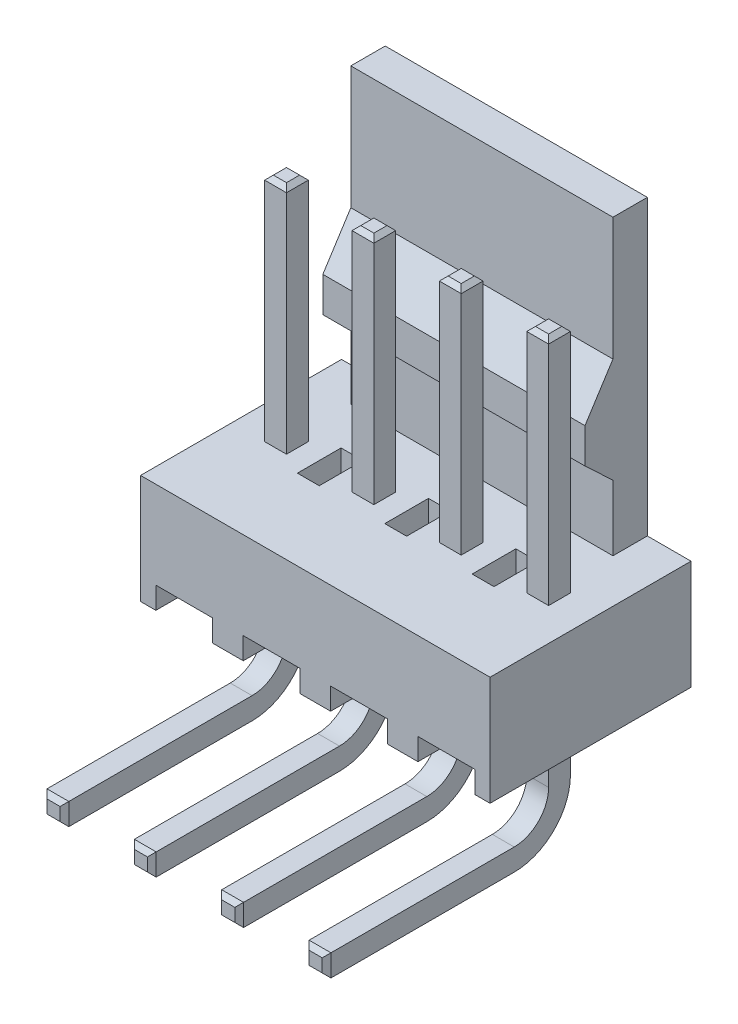
from build123d import *

# Parameters (mm, degrees)
SKETCH1_W            = 8.89
SKETCH1_H            = 5.842
BOSS_EXTRUDE1_DEPTH  = 3.175
BOSS_EXTRUDE2_DEPTH  = 7.62
SKETCH3_W            = 5.842
SKETCH3_H            = 3.175
BOSS_EXTRUDE3_DEPTH  = 1.27
SKETCH4_W            = 1.651
SKETCH4_H            = 0.635
CUT_EXTRUDE1_DEPTH   = 13.735698656
SKETCH5_W            = 0.635
SKETCH5_H            = 0.635
BOSS_EXTRUDE4_DEPTH  = 3.6725
SKETCH6_W            = 0.635
SKETCH6_H            = 0.635
BOSS_EXTRUDE5_DEPTH  = 6.4543
SKETCH7_W            = 1.651
SKETCH7_H            = 0.635
CUT_EXTRUDE2_DEPTH   = 15.867320547
SKETCH8_W            = 0.635
SKETCH8_H            = 0.635
BOSS_EXTRUDE6_DEPTH  = 3.6725
SKETCH9_W            = 0.635
SKETCH9_H            = 0.635
BOSS_EXTRUDE7_DEPTH  = 6.4543
SKETCH10_W           = 1.651
SKETCH10_H           = 0.635
CUT_EXTRUDE3_DEPTH   = 15.867320547
SKETCH11_W           = 0.635
SKETCH11_H           = 0.635
BOSS_EXTRUDE8_DEPTH  = 3.6725
SKETCH12_W           = 0.635
SKETCH12_H           = 0.635
BOSS_EXTRUDE9_DEPTH  = 6.4543
SKETCH13_W           = 1.651
SKETCH13_H           = 0.635
CUT_EXTRUDE4_DEPTH   = 15.867320547
SKETCH14_W           = 0.635
SKETCH14_H           = 0.635
BOSS_EXTRUDE10_DEPTH = 3.6725
SKETCH15_W           = 0.635
SKETCH15_H           = 0.635
BOSS_EXTRUDE11_DEPTH = 6.4543
SKETCH16_W           = 0.635
SKETCH16_H           = 0.635
BOSS_EXTRUDE12_DEPTH = 6.71
SKETCH17_W           = 0.635
SKETCH17_H           = 0.635
BOSS_EXTRUDE13_DEPTH = 6.71
SKETCH18_W           = 0.635
SKETCH18_H           = 0.635
BOSS_EXTRUDE14_DEPTH = 6.71
SKETCH19_W           = 0.635
SKETCH19_H           = 0.635
BOSS_EXTRUDE15_DEPTH = 6.71
SKETCH20_W           = 0.635
SKETCH20_H           = 1.27
CUT_EXTRUDE5_DEPTH   = 1.27
SKETCH21_W           = 0.635
SKETCH21_H           = 1.27
CUT_EXTRUDE6_DEPTH   = 1.27
SKETCH22_W           = 0.635
SKETCH22_H           = 1.27
CUT_EXTRUDE7_DEPTH   = 1.27
CHAMFER1_SIZE        = 0.127
CHAMFER2_SIZE        = 0.753913762
CHAMFER2_SIZE2       = 0.55706549
FILLET1_R            = 1
FILLET2_R            = 1.635


with BuildPart() as part:
    # Sketch1 → Boss-Extrude1 (new body)
    with BuildSketch(Plane.XZ.offset(1.5875)):
        with Locations((-0.635, 0.0508)):
            Rectangle(SKETCH1_W, SKETCH1_H)
    extrude(amount=-BOSS_EXTRUDE1_DEPTH)

    # Sketch2 → Boss-Extrude2 (add)
    with BuildSketch(Plane(origin=(3.81, 0, 0), x_dir=(0, 0, -1), z_dir=(1, 0, 0))):
        Polygon((0.651, 4.6355), (1.8702, 3.4925), (1.8702, 1.5875), (2.8702, 1.5875), (2.8702, 10.1125), (1.8702, 10.1125), (1.8702, 6.5405), align=None)
    extrude(amount=-BOSS_EXTRUDE2_DEPTH)

    # Sketch3 → Boss-Extrude3 (add)
    with BuildSketch(Plane(origin=(3.81, 0, 0), x_dir=(0, 0, -1), z_dir=(1, 0, 0))):
        with Locations((-0.0508, 0)):
            Rectangle(SKETCH3_W, SKETCH3_H)
    extrude(amount=BOSS_EXTRUDE3_DEPTH)

    # Sketch4 → Cut-Extrude1 (cut, through all)
    with BuildSketch(Plane(origin=(0, 0, -2.8702), x_dir=(-1, 0, 0), z_dir=(0, 0, -1))):
        with Locations((1.27, -1.27)):
            Rectangle(SKETCH4_W, SKETCH4_H)
    extrude(amount=-CUT_EXTRUDE1_DEPTH, mode=Mode.SUBTRACT)

    # Sketch5 → Boss-Extrude4 (add)
    with BuildSketch(Plane.XZ.offset(0.9525)):
        with Locations((-1.27, 0)):
            Rectangle(SKETCH5_W, SKETCH5_H)
    extrude(amount=BOSS_EXTRUDE4_DEPTH)

    # Sketch6 → Boss-Extrude5 (add)
    with BuildSketch(Plane.XY.offset(0.3175)):
        with Locations((-1.27, -4.3075)):
            Rectangle(SKETCH6_W, SKETCH6_H)
    extrude(amount=BOSS_EXTRUDE5_DEPTH)

    # Sketch7 → Cut-Extrude2 (cut, through all)
    with BuildSketch(Plane(origin=(0, 0, -2.8702), x_dir=(-1, 0, 0), z_dir=(0, 0, -1))):
        with Locations((-1.27, -1.27)):
            Rectangle(SKETCH7_W, SKETCH7_H)
    extrude(amount=-CUT_EXTRUDE2_DEPTH, mode=Mode.SUBTRACT)

    # Sketch8 → Boss-Extrude6 (add)
    with BuildSketch(Plane.XZ.offset(0.9525)):
        with Locations((1.27, 0)):
            Rectangle(SKETCH8_W, SKETCH8_H)
    extrude(amount=BOSS_EXTRUDE6_DEPTH)

    # Sketch9 → Boss-Extrude7 (add)
    with BuildSketch(Plane.XY.offset(0.3175)):
        with Locations((1.27, -4.3075)):
            Rectangle(SKETCH9_W, SKETCH9_H)
    extrude(amount=BOSS_EXTRUDE7_DEPTH)

    # Sketch10 → Cut-Extrude3 (cut, through all)
    with BuildSketch(Plane(origin=(0, 0, -2.8702), x_dir=(-1, 0, 0), z_dir=(0, 0, -1))):
        with Locations((3.81, -1.27)):
            Rectangle(SKETCH10_W, SKETCH10_H)
    extrude(amount=-CUT_EXTRUDE3_DEPTH, mode=Mode.SUBTRACT)

    # Sketch11 → Boss-Extrude8 (add)
    with BuildSketch(Plane.XZ.offset(0.9525)):
        with Locations((-3.81, 0)):
            Rectangle(SKETCH11_W, SKETCH11_H)
    extrude(amount=BOSS_EXTRUDE8_DEPTH)

    # Sketch12 → Boss-Extrude9 (add)
    with BuildSketch(Plane.XY.offset(0.3175)):
        with Locations((-3.81, -4.3075)):
            Rectangle(SKETCH12_W, SKETCH12_H)
    extrude(amount=BOSS_EXTRUDE9_DEPTH)

    # Sketch13 → Cut-Extrude4 (cut, through all)
    with BuildSketch(Plane(origin=(0, 0, -2.8702), x_dir=(-1, 0, 0), z_dir=(0, 0, -1))):
        with Locations((-3.81, -1.27)):
            Rectangle(SKETCH13_W, SKETCH13_H)
    extrude(amount=-CUT_EXTRUDE4_DEPTH, mode=Mode.SUBTRACT)

    # Sketch14 → Boss-Extrude10 (add)
    with BuildSketch(Plane.XZ.offset(0.9525)):
        with Locations((3.81, 0)):
            Rectangle(SKETCH14_W, SKETCH14_H)
    extrude(amount=BOSS_EXTRUDE10_DEPTH)

    # Sketch15 → Boss-Extrude11 (add)
    with BuildSketch(Plane.XY.offset(0.3175)):
        with Locations((3.81, -4.3075)):
            Rectangle(SKETCH15_W, SKETCH15_H)
    extrude(amount=BOSS_EXTRUDE11_DEPTH)

    # Sketch16 → Boss-Extrude12 (add)
    with BuildSketch(Plane(origin=(0, 1.5875, 0), x_dir=(-1, 0, 0), z_dir=(0, 1, 0))):
        with Locations((-3.81, 0)):
            Rectangle(SKETCH16_W, SKETCH16_H)
    extrude(amount=BOSS_EXTRUDE12_DEPTH)

    # Sketch17 → Boss-Extrude13 (add)
    with BuildSketch(Plane(origin=(0, 1.5875, 0), x_dir=(-1, 0, 0), z_dir=(0, 1, 0))):
        with Locations((-1.27, 0)):
            Rectangle(SKETCH17_W, SKETCH17_H)
    extrude(amount=BOSS_EXTRUDE13_DEPTH)

    # Sketch18 → Boss-Extrude14 (add)
    with BuildSketch(Plane(origin=(0, 1.5875, 0), x_dir=(-1, 0, 0), z_dir=(0, 1, 0))):
        with Locations((1.27, 0)):
            Rectangle(SKETCH18_W, SKETCH18_H)
    extrude(amount=BOSS_EXTRUDE14_DEPTH)

    # Sketch19 → Boss-Extrude15 (add)
    with BuildSketch(Plane(origin=(0, 1.5875, 0), x_dir=(-1, 0, 0), z_dir=(0, 1, 0))):
        with Locations((3.81, 0)):
            Rectangle(SKETCH19_W, SKETCH19_H)
    extrude(amount=BOSS_EXTRUDE15_DEPTH)

    # Sketch20 → Cut-Extrude5 (cut)
    with BuildSketch(Plane(origin=(0, 1.5875, 0), x_dir=(-1, 0, 0), z_dir=(0, 1, 0))):
        with Locations((-2.54, 0)):
            Rectangle(SKETCH20_W, SKETCH20_H)
    extrude(amount=-CUT_EXTRUDE5_DEPTH, mode=Mode.SUBTRACT)

    # Sketch21 → Cut-Extrude6 (cut)
    with BuildSketch(Plane(origin=(0, 1.5875, 0), x_dir=(-1, 0, 0), z_dir=(0, 1, 0))):
        Rectangle(SKETCH21_W, SKETCH21_H)
    extrude(amount=-CUT_EXTRUDE6_DEPTH, mode=Mode.SUBTRACT)

    # Sketch22 → Cut-Extrude7 (cut)
    with BuildSketch(Plane(origin=(0, 1.5875, 0), x_dir=(-1, 0, 0), z_dir=(0, 1, 0))):
        with Locations((2.54, 0)):
            Rectangle(SKETCH22_W, SKETCH22_H)
    extrude(amount=-CUT_EXTRUDE7_DEPTH, mode=Mode.SUBTRACT)

    # Chamfer1
    chamfer1_edges = [part.edges().sort_by_distance(p)[0] for p in [
        (1.5875, -4.3075, 6.7718),
        (1.27, -3.99, 6.7718),
        (0.9525, -4.3075, 6.7718),
        (1.27, -4.625, 6.7718),
        (-3.4925, -4.3075, 6.7718),
        (-3.81, -3.99, 6.7718),
        (-4.1275, -4.3075, 6.7718),
        (-3.81, -4.625, 6.7718),
        (4.1275, -4.3075, 6.7718),
        (3.81, -3.99, 6.7718),
        (3.4925, -4.3075, 6.7718),
        (3.81, -4.625, 6.7718),
        (4.1275, 8.2975, 0),
        (3.81, 8.2975, -0.3175),
        (3.4925, 8.2975, 0),
        (3.81, 8.2975, 0.3175),
        (0.9525, 8.2975, 0),
        (1.27, 8.2975, 0.3175),
        (1.5875, 8.2975, 0),
        (1.27, 8.2975, -0.3175),
        (-0.9525, 8.2975, 0),
        (-1.27, 8.2975, -0.3175),
        (-1.5875, 8.2975, 0),
        (-1.27, 8.2975, 0.3175),
        (-3.81, 8.2975, -0.3175),
        (-4.1275, 8.2975, 0),
        (-3.81, 8.2975, 0.3175),
        (-3.4925, 8.2975, 0),
        (-1.27, -3.99, 6.7718),
        (-1.5875, -4.3075, 6.7718),
        (-1.27, -4.625, 6.7718),
        (-0.9525, -4.3075, 6.7718),
    ]]
    chamfer(chamfer1_edges, length=CHAMFER1_SIZE)

    # Chamfer2
    chamfer2_edges = [part.edges().sort_by_distance(p)[0] for p in [
        (0, 4.6355, -0.651),
    ]]
    chamfer2_side = [part.faces().sort_by_distance(p)[0] for p in [
        (0, 5.588, -1.2606),
    ]]
    chamfer(chamfer2_edges, length=CHAMFER2_SIZE, length2=CHAMFER2_SIZE2, reference=chamfer2_side[0])

    # Fillet1
    fillet1_edges = [part.edges().sort_by_distance(p)[0] for p in [
        (1.27, -3.99, 0.3175),
        (-3.81, -3.99, 0.3175),
        (3.81, -3.99, 0.3175),
        (-1.27, -3.99, 0.3175),
    ]]
    fillet(fillet1_edges, radius=FILLET1_R)

    # Fillet2
    fillet2_edges = [part.edges().sort_by_distance(p)[0] for p in [
        (1.27, -4.625, -0.3175),
        (-3.81, -4.625, -0.3175),
        (3.81, -4.625, -0.3175),
        (-1.27, -4.625, -0.3175),
    ]]
    fillet(fillet2_edges, radius=FILLET2_R)


solid = part.part
